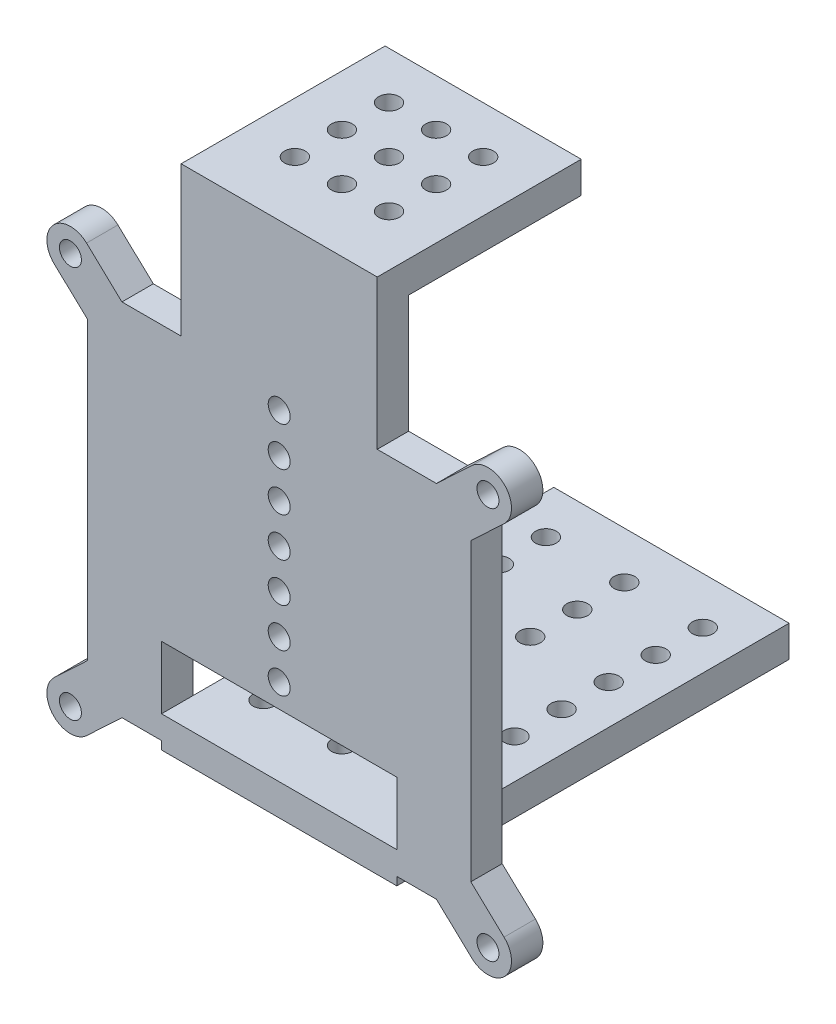
from build123d import *

# Parameters (mm, degrees)
SKETCH_1_W                      = 25
SKETCH_1_H                      = 58
SKETCH_1_R                      = 1.4
EXTRUDE_1_DEPTH                 = 4
SKETCH_2_R                      = 1.4
EXTRUDE_2_DEPTH                 = 4
SKETCH_1_2_R                    = 1.4
CUT_EXTRUDE_1_DEPTH             = 4
EXTRUDE_START                   = 4
SKETCH_3_W                      = 25
SKETCH_3_H                      = 4
EXTRUDE_3_DEPTH                 = 26
SKETCH_4_R                      = 1.325
CUT_EXTRUDE_2_DEPTH             = 4
SKETCH_3_3_W                    = 30
SKETCH_3_3_H                    = 4
EXTRUDE_4_DEPTH                 = 50
CUT_EXTRUDE_3_REACH             = 87.702
SKETCH_5_R                      = 1.325
CUT_EXTRUDE_3_DIRECTION_2_DEPTH = 86.70184362
SKETCH_6_W                      = 30
SKETCH_6_H                      = 8
CUT_EXTRUDE_4_DEPTH             = 50


with BuildPart() as part:
    # 草图1 → 凸台-拉伸1 (new body)
    with BuildSketch(Plane.XY):
        with Locations((0, 10)):
            Rectangle(SKETCH_1_W, SKETCH_1_H)
        with Locations((0, 22)):
            Circle(SKETCH_1_R, mode=Mode.SUBTRACT)
        with Locations((0, 17)):
            Circle(SKETCH_1_R, mode=Mode.SUBTRACT)
        with Locations((0, 12)):
            Circle(SKETCH_1_R, mode=Mode.SUBTRACT)
        with Locations((0, 7)):
            Circle(SKETCH_1_R, mode=Mode.SUBTRACT)
        with Locations((0, 2)):
            Circle(SKETCH_1_R, mode=Mode.SUBTRACT)
        with Locations((0, -3)):
            Circle(SKETCH_1_R, mode=Mode.SUBTRACT)
        with Locations((0, -8)):
            Circle(SKETCH_1_R, mode=Mode.SUBTRACT)
        with Locations((0, -13)):
            Circle(SKETCH_1_R, mode=Mode.SUBTRACT)
    extrude(amount=EXTRUDE_1_DEPTH)

    # 草图2 → 凸台-拉伸2 (add)
    with BuildSketch(Plane.XY):
        with BuildLine():
            Line((-20.043899839, 23.945721469), (-24.557028794, 28.186307325))
            ThreePointArc((-24.557028794, 28.186307325), (-28.79761465, 28.054278531), (-28.665585855, 23.813692675))
            Line((-28.665585855, 23.813692675), (-24.425, 19.829191329))
            Line((-24.425, 19.829191329), (-24.425, -17.83774839))
            Line((-24.425, -17.83774839), (-28.665585855, -21.822249736))
            ThreePointArc((-28.665585855, -21.822249736), (-28.79761465, -26.062835592), (-24.557028794, -26.194864386))
            Line((-24.557028794, -26.194864386), (-20.043899839, -21.954278531))
            Line((-20.043899839, -21.954278531), (20.043899839, -21.954278531))
            Line((20.043899839, -21.954278531), (24.557028794, -26.194864386))
            ThreePointArc((24.557028794, -26.194864386), (28.79761465, -26.062835592), (28.665585855, -21.822249736))
            Line((28.665585855, -21.822249736), (24.425, -17.83774839))
            Line((24.425, -17.83774839), (24.425, 19.829191329))
            Line((24.425, 19.829191329), (28.665585855, 23.813692675))
            ThreePointArc((28.665585855, 23.813692675), (28.79761465, 28.054278531), (24.557028794, 28.186307325))
            Line((24.557028794, 28.186307325), (20.043899839, 23.945721469))
            Line((20.043899839, 23.945721469), (-20.043899839, 23.945721469))
        make_face()
        with Locations((-26.611307325, 26)):
            Circle(SKETCH_2_R, mode=Mode.SUBTRACT)
        with Locations((26.611307325, 26)):
            Circle(SKETCH_2_R, mode=Mode.SUBTRACT)
        with Locations((-26.611307325, -24.008557061)):
            Circle(SKETCH_2_R, mode=Mode.SUBTRACT)
        with Locations((26.611307325, -24.008557061)):
            Circle(SKETCH_2_R, mode=Mode.SUBTRACT)
        with BuildLine():
            Line((11.022703843, 3.245721469), (11.549645381, 3.245721469))
            Line((11.549645381, 3.245721469), (11.549645381, -1.254278531))
            Line((11.549645381, -1.254278531), (11.022703843, -1.254278531))
            ThreePointArc((11.022703843, -1.254278531), (-11.25, 0.995721469), (11.022703843, 3.245721469))
        make_face(mode=Mode.SUBTRACT)
    extrude(amount=EXTRUDE_2_DEPTH)

    # 草图1<2> → 切除-拉伸1 (cut)
    with BuildSketch(Plane.XY):
        with Locations((0, 22)):
            Circle(SKETCH_1_2_R)
        with Locations((0, 17)):
            Circle(SKETCH_1_2_R)
        with Locations((0, 12)):
            Circle(SKETCH_1_2_R)
        with Locations((0, -13)):
            Circle(SKETCH_1_2_R)
    extrude(amount=CUT_EXTRUDE_1_DEPTH, mode=Mode.SUBTRACT)

    # 草图3 → 凸台-拉伸3 (add)
    with BuildSketch(Plane.XY.offset(EXTRUDE_START)):
        with Locations((0, 40.969511733)):
            Rectangle(SKETCH_3_W, SKETCH_3_H)
    extrude(amount=-EXTRUDE_3_DEPTH)

    # 草图4 → 切除-拉伸2 (cut)
    with BuildSketch(Plane(origin=(0, 42.969511733, 0), x_dir=(1, 0, 0), z_dir=(0, 1, 0))):
        with Locations(Location((0, 4, 0), (0, 0, 270))):
            Circle(SKETCH_4_R)
        with Locations(Location((6, 4, 0), (0, 0, 270))):
            Circle(SKETCH_4_R)
        with Locations(Location((6, 10, 0), (0, 0, 270))):
            Circle(SKETCH_4_R)
        with Locations(Location((0, 10, 0), (0, 0, 270))):
            Circle(SKETCH_4_R)
        with Locations(Location((0, 16, 0), (0, 0, 270))):
            Circle(SKETCH_4_R)
        with Locations(Location((6, 16, 0), (0, 0, 270))):
            Circle(SKETCH_4_R)
        with Locations(Location((-6, 4, 0), (0, 0, 270))):
            Circle(SKETCH_4_R)
        with Locations(Location((-6, 10, 0), (0, 0, 270))):
            Circle(SKETCH_4_R)
        with Locations(Location((-6, 16, 0), (0, 0, 270))):
            Circle(SKETCH_4_R)
    extrude(amount=-CUT_EXTRUDE_2_DEPTH, mode=Mode.SUBTRACT)

    # 草图3<3> → 凸台-拉伸4 (add)
    with BuildSketch(Plane.XY.offset(EXTRUDE_START)):
        with Locations((0, -21)):
            Rectangle(SKETCH_3_3_W, SKETCH_3_3_H)
    extrude(amount=-EXTRUDE_4_DEPTH)

    # 草图5 → 切除-拉伸3 (cut, up to next)
    with BuildSketch(Plane.XZ.offset(23), mode=Mode.PRIVATE) as cut_extrude_3_sk1:
        with Locations(Location((0, -4, 0), (0, 0, 90))):
            Circle(SKETCH_5_R)
    cut_extrude_3_tool1 = extrude(cut_extrude_3_sk1.sketch, amount=-CUT_EXTRUDE_3_REACH, mode=Mode.PRIVATE) & part.part
    # 草图5 → 切除-拉伸3 (cut, up to next)
    with BuildSketch(Plane.XZ.offset(23), mode=Mode.PRIVATE) as cut_extrude_3_sk2:
        with Locations(Location((10, -4, 0), (0, 0, 180))):
            Circle(SKETCH_5_R)
    cut_extrude_3_tool2 = extrude(cut_extrude_3_sk2.sketch, amount=-CUT_EXTRUDE_3_REACH, mode=Mode.PRIVATE) & part.part
    # 草图5 → 切除-拉伸3 (cut, up to next)
    with BuildSketch(Plane.XZ.offset(23), mode=Mode.PRIVATE) as cut_extrude_3_sk3:
        with Locations(Location((10, -10, 0), (0, 0, 180))):
            Circle(SKETCH_5_R)
    cut_extrude_3_tool3 = extrude(cut_extrude_3_sk3.sketch, amount=-CUT_EXTRUDE_3_REACH, mode=Mode.PRIVATE) & part.part
    # 草图5 → 切除-拉伸3 (cut, up to next)
    with BuildSketch(Plane.XZ.offset(23), mode=Mode.PRIVATE) as cut_extrude_3_sk4:
        with Locations(Location((10, -16, 0), (0, 0, 180))):
            Circle(SKETCH_5_R)
    cut_extrude_3_tool4 = extrude(cut_extrude_3_sk4.sketch, amount=-CUT_EXTRUDE_3_REACH, mode=Mode.PRIVATE) & part.part
    # 草图5 → 切除-拉伸3 (cut, up to next)
    with BuildSketch(Plane.XZ.offset(23), mode=Mode.PRIVATE) as cut_extrude_3_sk5:
        with Locations(Location((10, -22, 0), (0, 0, 180))):
            Circle(SKETCH_5_R)
    cut_extrude_3_tool5 = extrude(cut_extrude_3_sk5.sketch, amount=-CUT_EXTRUDE_3_REACH, mode=Mode.PRIVATE) & part.part
    # 草图5 → 切除-拉伸3 (cut, up to next)
    with BuildSketch(Plane.XZ.offset(23), mode=Mode.PRIVATE) as cut_extrude_3_sk6:
        with Locations(Location((10, -28, 0), (0, 0, 180))):
            Circle(SKETCH_5_R)
    cut_extrude_3_tool6 = extrude(cut_extrude_3_sk6.sketch, amount=-CUT_EXTRUDE_3_REACH, mode=Mode.PRIVATE) & part.part
    # 草图5 → 切除-拉伸3 (cut, up to next)
    with BuildSketch(Plane.XZ.offset(23), mode=Mode.PRIVATE) as cut_extrude_3_sk7:
        with Locations(Location((10, -34, 0), (0, 0, 180))):
            Circle(SKETCH_5_R)
    cut_extrude_3_tool7 = extrude(cut_extrude_3_sk7.sketch, amount=-CUT_EXTRUDE_3_REACH, mode=Mode.PRIVATE) & part.part
    # 草图5 → 切除-拉伸3 (cut, up to next)
    with BuildSketch(Plane.XZ.offset(23), mode=Mode.PRIVATE) as cut_extrude_3_sk8:
        with Locations(Location((10, -40, 0), (0, 0, 180))):
            Circle(SKETCH_5_R)
    cut_extrude_3_tool8 = extrude(cut_extrude_3_sk8.sketch, amount=-CUT_EXTRUDE_3_REACH, mode=Mode.PRIVATE) & part.part
    # 草图5 → 切除-拉伸3 (cut, up to next)
    with BuildSketch(Plane.XZ.offset(23), mode=Mode.PRIVATE) as cut_extrude_3_sk9:
        with Locations(Location((0, -10, 0), (0, 0, 90))):
            Circle(SKETCH_5_R)
    cut_extrude_3_tool9 = extrude(cut_extrude_3_sk9.sketch, amount=-CUT_EXTRUDE_3_REACH, mode=Mode.PRIVATE) & part.part
    # 草图5 → 切除-拉伸3 (cut, up to next)
    with BuildSketch(Plane.XZ.offset(23), mode=Mode.PRIVATE) as cut_extrude_3_sk10:
        with Locations(Location((0, -16, 0), (0, 0, 90))):
            Circle(SKETCH_5_R)
    cut_extrude_3_tool10 = extrude(cut_extrude_3_sk10.sketch, amount=-CUT_EXTRUDE_3_REACH, mode=Mode.PRIVATE) & part.part
    # 草图5 → 切除-拉伸3 (cut, up to next)
    with BuildSketch(Plane.XZ.offset(23), mode=Mode.PRIVATE) as cut_extrude_3_sk11:
        with Locations(Location((0, -22, 0), (0, 0, 180))):
            Circle(SKETCH_5_R)
    cut_extrude_3_tool11 = extrude(cut_extrude_3_sk11.sketch, amount=-CUT_EXTRUDE_3_REACH, mode=Mode.PRIVATE) & part.part
    # 草图5 → 切除-拉伸3 (cut, up to next)
    with BuildSketch(Plane.XZ.offset(23), mode=Mode.PRIVATE) as cut_extrude_3_sk12:
        with Locations(Location((0, -28, 0), (0, 0, 180))):
            Circle(SKETCH_5_R)
    cut_extrude_3_tool12 = extrude(cut_extrude_3_sk12.sketch, amount=-CUT_EXTRUDE_3_REACH, mode=Mode.PRIVATE) & part.part
    # 草图5 → 切除-拉伸3 (cut, up to next)
    with BuildSketch(Plane.XZ.offset(23), mode=Mode.PRIVATE) as cut_extrude_3_sk13:
        with Locations(Location((0, -34, 0), (0, 0, 180))):
            Circle(SKETCH_5_R)
    cut_extrude_3_tool13 = extrude(cut_extrude_3_sk13.sketch, amount=-CUT_EXTRUDE_3_REACH, mode=Mode.PRIVATE) & part.part
    # 草图5 → 切除-拉伸3 (cut, up to next)
    with BuildSketch(Plane.XZ.offset(23), mode=Mode.PRIVATE) as cut_extrude_3_sk14:
        with Locations(Location((0, -40, 0), (0, 0, 180))):
            Circle(SKETCH_5_R)
    cut_extrude_3_tool14 = extrude(cut_extrude_3_sk14.sketch, amount=-CUT_EXTRUDE_3_REACH, mode=Mode.PRIVATE) & part.part
    # 草图5 → 切除-拉伸3 (cut, up to next)
    with BuildSketch(Plane.XZ.offset(23), mode=Mode.PRIVATE) as cut_extrude_3_sk15:
        with Locations(Location((-10, -40, 0), (0, 0, 180))):
            Circle(SKETCH_5_R)
    cut_extrude_3_tool15 = extrude(cut_extrude_3_sk15.sketch, amount=-CUT_EXTRUDE_3_REACH, mode=Mode.PRIVATE) & part.part
    # 草图5 → 切除-拉伸3 (cut, up to next)
    with BuildSketch(Plane.XZ.offset(23), mode=Mode.PRIVATE) as cut_extrude_3_sk16:
        with Locations(Location((-10, -34, 0), (0, 0, 180))):
            Circle(SKETCH_5_R)
    cut_extrude_3_tool16 = extrude(cut_extrude_3_sk16.sketch, amount=-CUT_EXTRUDE_3_REACH, mode=Mode.PRIVATE) & part.part
    # 草图5 → 切除-拉伸3 (cut, up to next)
    with BuildSketch(Plane.XZ.offset(23), mode=Mode.PRIVATE) as cut_extrude_3_sk17:
        with Locations(Location((-10, -28, 0), (0, 0, 180))):
            Circle(SKETCH_5_R)
    cut_extrude_3_tool17 = extrude(cut_extrude_3_sk17.sketch, amount=-CUT_EXTRUDE_3_REACH, mode=Mode.PRIVATE) & part.part
    # 草图5 → 切除-拉伸3 (cut, up to next)
    with BuildSketch(Plane.XZ.offset(23), mode=Mode.PRIVATE) as cut_extrude_3_sk18:
        with Locations(Location((-10, -22, 0), (0, 0, 180))):
            Circle(SKETCH_5_R)
    cut_extrude_3_tool18 = extrude(cut_extrude_3_sk18.sketch, amount=-CUT_EXTRUDE_3_REACH, mode=Mode.PRIVATE) & part.part
    # 草图5 → 切除-拉伸3 (cut, up to next)
    with BuildSketch(Plane.XZ.offset(23), mode=Mode.PRIVATE) as cut_extrude_3_sk19:
        with Locations(Location((-10, -16, 0), (0, 0, 180))):
            Circle(SKETCH_5_R)
    cut_extrude_3_tool19 = extrude(cut_extrude_3_sk19.sketch, amount=-CUT_EXTRUDE_3_REACH, mode=Mode.PRIVATE) & part.part
    # 草图5 → 切除-拉伸3 (cut, up to next)
    with BuildSketch(Plane.XZ.offset(23), mode=Mode.PRIVATE) as cut_extrude_3_sk20:
        with Locations(Location((-10, -10, 0), (0, 0, 180))):
            Circle(SKETCH_5_R)
    cut_extrude_3_tool20 = extrude(cut_extrude_3_sk20.sketch, amount=-CUT_EXTRUDE_3_REACH, mode=Mode.PRIVATE) & part.part
    # 草图5 → 切除-拉伸3 (cut, up to next)
    with BuildSketch(Plane.XZ.offset(23), mode=Mode.PRIVATE) as cut_extrude_3_sk21:
        with Locations(Location((-10, -4, 0), (0, 0, 180))):
            Circle(SKETCH_5_R)
    cut_extrude_3_tool21 = extrude(cut_extrude_3_sk21.sketch, amount=-CUT_EXTRUDE_3_REACH, mode=Mode.PRIVATE) & part.part
    add(cut_extrude_3_tool1.solids().sort_by_distance((0, -23, -4))[0], mode=Mode.SUBTRACT)
    add(cut_extrude_3_tool2.solids().sort_by_distance((10, -23, -4))[0], mode=Mode.SUBTRACT)
    add(cut_extrude_3_tool3.solids().sort_by_distance((10, -23, -10))[0], mode=Mode.SUBTRACT)
    add(cut_extrude_3_tool4.solids().sort_by_distance((10, -23, -16))[0], mode=Mode.SUBTRACT)
    add(cut_extrude_3_tool5.solids().sort_by_distance((10, -23, -22))[0], mode=Mode.SUBTRACT)
    add(cut_extrude_3_tool6.solids().sort_by_distance((10, -23, -28))[0], mode=Mode.SUBTRACT)
    add(cut_extrude_3_tool7.solids().sort_by_distance((10, -23, -34))[0], mode=Mode.SUBTRACT)
    add(cut_extrude_3_tool8.solids().sort_by_distance((10, -23, -40))[0], mode=Mode.SUBTRACT)
    add(cut_extrude_3_tool9.solids().sort_by_distance((0, -23, -10))[0], mode=Mode.SUBTRACT)
    add(cut_extrude_3_tool10.solids().sort_by_distance((0, -23, -16))[0], mode=Mode.SUBTRACT)
    add(cut_extrude_3_tool11.solids().sort_by_distance((0, -23, -22))[0], mode=Mode.SUBTRACT)
    add(cut_extrude_3_tool12.solids().sort_by_distance((0, -23, -28))[0], mode=Mode.SUBTRACT)
    add(cut_extrude_3_tool13.solids().sort_by_distance((0, -23, -34))[0], mode=Mode.SUBTRACT)
    add(cut_extrude_3_tool14.solids().sort_by_distance((0, -23, -40))[0], mode=Mode.SUBTRACT)
    add(cut_extrude_3_tool15.solids().sort_by_distance((-10, -23, -40))[0], mode=Mode.SUBTRACT)
    add(cut_extrude_3_tool16.solids().sort_by_distance((-10, -23, -34))[0], mode=Mode.SUBTRACT)
    add(cut_extrude_3_tool17.solids().sort_by_distance((-10, -23, -28))[0], mode=Mode.SUBTRACT)
    add(cut_extrude_3_tool18.solids().sort_by_distance((-10, -23, -22))[0], mode=Mode.SUBTRACT)
    add(cut_extrude_3_tool19.solids().sort_by_distance((-10, -23, -16))[0], mode=Mode.SUBTRACT)
    add(cut_extrude_3_tool20.solids().sort_by_distance((-10, -23, -10))[0], mode=Mode.SUBTRACT)
    add(cut_extrude_3_tool21.solids().sort_by_distance((-10, -23, -4))[0], mode=Mode.SUBTRACT)

    # 草图5 → 切除-拉伸3 direction 2 (cut)
    with BuildSketch(Plane.XZ.offset(23)):
        with Locations(Location((0, -4, 0), (0, 0, 90))):
            Circle(SKETCH_5_R)
        with Locations(Location((10, -4, 0), (0, 0, 180))):
            Circle(SKETCH_5_R)
        with Locations(Location((10, -10, 0), (0, 0, 180))):
            Circle(SKETCH_5_R)
        with Locations(Location((10, -16, 0), (0, 0, 180))):
            Circle(SKETCH_5_R)
        with Locations(Location((10, -22, 0), (0, 0, 180))):
            Circle(SKETCH_5_R)
        with Locations(Location((10, -28, 0), (0, 0, 180))):
            Circle(SKETCH_5_R)
        with Locations(Location((10, -34, 0), (0, 0, 180))):
            Circle(SKETCH_5_R)
        with Locations(Location((10, -40, 0), (0, 0, 180))):
            Circle(SKETCH_5_R)
        with Locations(Location((0, -10, 0), (0, 0, 90))):
            Circle(SKETCH_5_R)
        with Locations(Location((0, -16, 0), (0, 0, 90))):
            Circle(SKETCH_5_R)
        with Locations(Location((0, -22, 0), (0, 0, 180))):
            Circle(SKETCH_5_R)
        with Locations(Location((0, -28, 0), (0, 0, 180))):
            Circle(SKETCH_5_R)
        with Locations(Location((0, -34, 0), (0, 0, 180))):
            Circle(SKETCH_5_R)
        with Locations(Location((0, -40, 0), (0, 0, 180))):
            Circle(SKETCH_5_R)
        with Locations(Location((-10, -40, 0), (0, 0, 180))):
            Circle(SKETCH_5_R)
        with Locations(Location((-10, -34, 0), (0, 0, 180))):
            Circle(SKETCH_5_R)
        with Locations(Location((-10, -28, 0), (0, 0, 180))):
            Circle(SKETCH_5_R)
        with Locations(Location((-10, -22, 0), (0, 0, 180))):
            Circle(SKETCH_5_R)
        with Locations(Location((-10, -16, 0), (0, 0, 180))):
            Circle(SKETCH_5_R)
        with Locations(Location((-10, -10, 0), (0, 0, 180))):
            Circle(SKETCH_5_R)
        with Locations(Location((-10, -4, 0), (0, 0, 180))):
            Circle(SKETCH_5_R)
    extrude(amount=CUT_EXTRUDE_3_DIRECTION_2_DEPTH, mode=Mode.SUBTRACT)

    # 草图6 → 切除-拉伸4 (cut)
    with BuildSketch(Plane.XY.offset(4)):
        with Locations((0, -15)):
            Rectangle(SKETCH_6_W, SKETCH_6_H)
    extrude(amount=-CUT_EXTRUDE_4_DEPTH, mode=Mode.SUBTRACT)


solid = part.part
